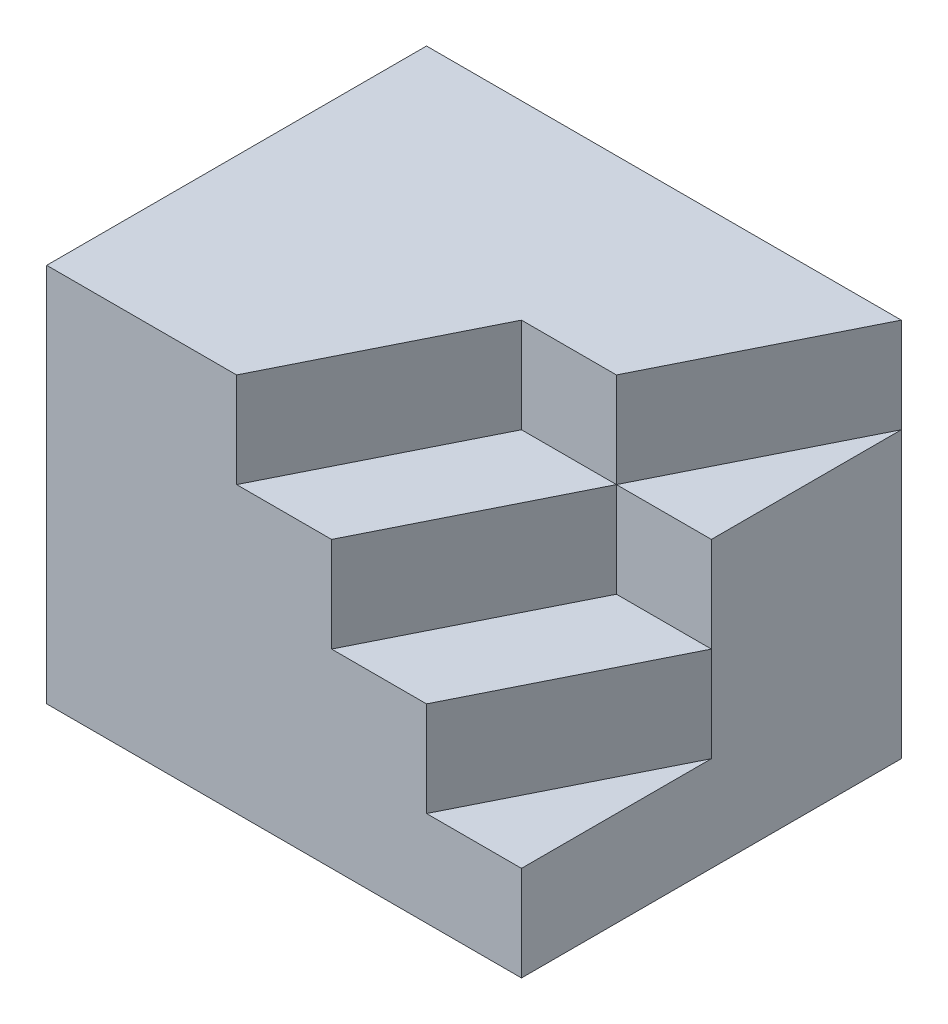
from build123d import *

# Parameters (mm, degrees)
BOSS_EXTRUDE1_DEPTH = 40
BOSS_EXTRUDE2_DEPTH = 30
BOSS_EXTRUDE3_DEPTH = 20
BOSS_EXTRUDE4_DEPTH = 10


with BuildPart() as part:
    # Sketch1 → Boss-Extrude1 (new body)
    with BuildSketch(Plane(origin=(0, 0, 0), x_dir=(1, 0, 0), z_dir=(0, 1, 0))):
        Polygon((5, 0), (15, 0), (25, 20), (-25, 20), (-25, -20), (-5, -20), align=None)
    extrude(amount=BOSS_EXTRUDE1_DEPTH)

    # Sketch1<3> → Boss-Extrude2 (add)
    with BuildSketch(Plane(origin=(0, 0, 0), x_dir=(1, 0, 0), z_dir=(0, 1, 0))):
        Polygon((-5, -20), (5, -20), (15, 0), (5, 0), align=None)
        Polygon((25, 20), (15, 0), (25, 0), align=None)
    extrude(amount=BOSS_EXTRUDE2_DEPTH)

    # Sketch1<4> → Boss-Extrude3 (add)
    with BuildSketch(Plane(origin=(0, 0, 0), x_dir=(1, 0, 0), z_dir=(0, 1, 0))):
        Polygon((15, 0), (5, -20), (15, -20), (25, 0), align=None)
    extrude(amount=BOSS_EXTRUDE3_DEPTH)

    # Sketch1<5> → Boss-Extrude4 (add)
    with BuildSketch(Plane(origin=(0, 0, 0), x_dir=(1, 0, 0), z_dir=(0, 1, 0))):
        Polygon((25, 0), (15, -20), (25, -20), align=None)
    extrude(amount=BOSS_EXTRUDE4_DEPTH)


solid = part.part
